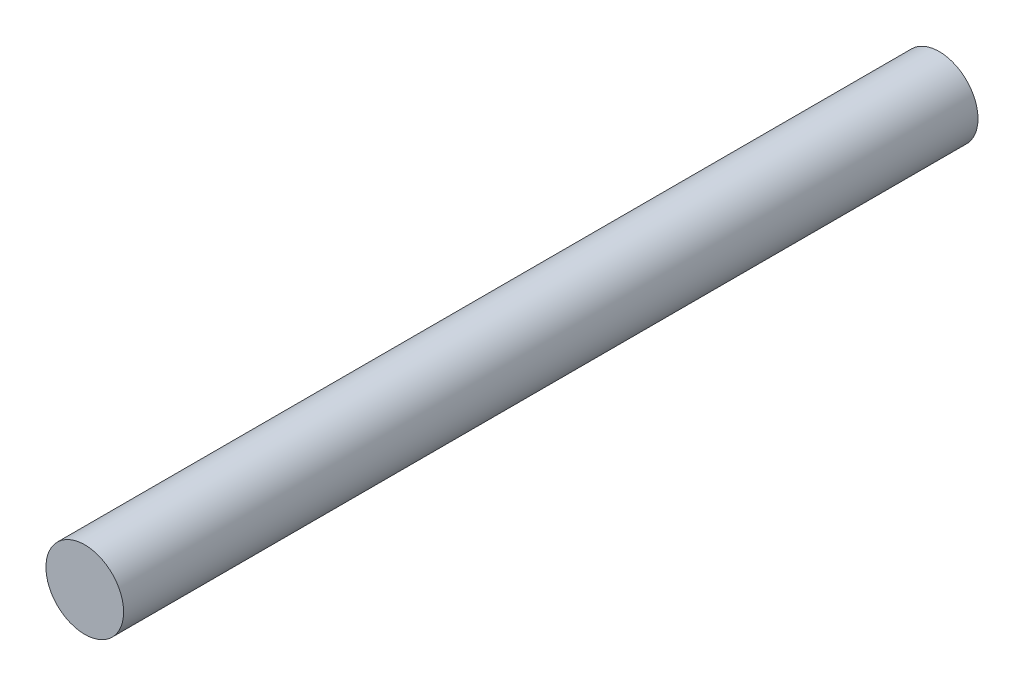
from build123d import *

# Parameters (mm, degrees)
SKETCH1_R           = 12
BOSS_EXTRUDE1_DEPTH = 132


with BuildPart() as part:
    # Sketch1 → Boss-Extrude1 (new, symmetric)
    with BuildSketch(Plane.XY):
        Circle(SKETCH1_R)
    extrude(amount=BOSS_EXTRUDE1_DEPTH, both=True)


solid = part.part
